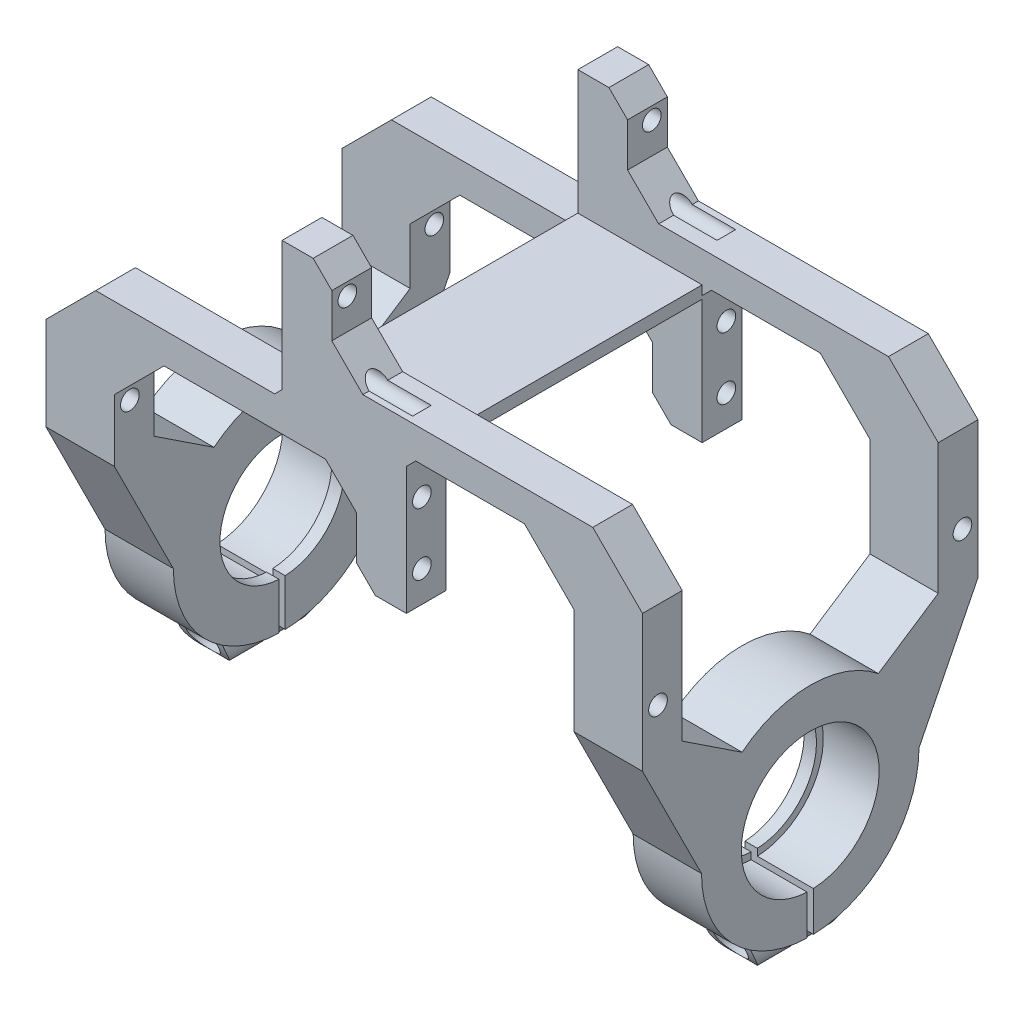
from build123d import *

# Parameters (mm, degrees)
SKETCH1_W               = 20
SKETCH1_H               = 54
BOSS_EXTRUDE1_DEPTH     = 2
SKETCH2_W               = 8
SKETCH2_H               = 6.4
BOSS_EXTRUDE2_DEPTH     = 20
CHAMFER1_SIZE           = 5
SKETCH3_W               = 8
SKETCH3_H               = 6.4
BOSS_EXTRUDE3_DEPTH     = 20
CHAMFER2_SIZE           = 5
CHAMFER3_SIZE           = 3
BOSS_EXTRUDE4_DEPTH     = 6.4
BOSS_EXTRUDE6_DEPTH     = 6.4
CHAMFER4_SIZE           = 5
CHAMFER5_SIZE           = 1.5
SKETCH6_R               = 11.1
BOSS_EXTRUDE5_DEPTH     = 11
CHAMFER6_SIZE           = 8
BOSS_EXTRUDE7_DEPTH     = 6.4
BOSS_EXTRUDE8_DEPTH     = 6.4
BOSS_EXTRUDE9_START     = -11
SKETCH10_W              = 6.4
SKETCH10_H              = 1
SKETCH10_H_2            = 5
SKETCH10_R              = 11.1
SKETCH10_H_3            = 6
BOSS_EXTRUDE9_DEPTH     = 11
BOSS_EXTRUDE10_START    = -11
SKETCH11_R              = 11.1
SKETCH11_R_2            = 10
BOSS_EXTRUDE10_DEPTH    = 2
BOSS_EXTRUDE11_START    = -9
SKETCH12_R              = 11.1
SKETCH12_R_2            = 10
BOSS_EXTRUDE11_DEPTH    = 2
CHAMFER7_SIZE           = 8
CHAMFER8_SIZE           = 5
SKETCH13_R              = 1.5
CUT_EXTRUDE1_DEPTH      = 20
CHAMFER9_SIZE           = 1.2
BOSS_EXTRUDE12_DEPTH    = 8
SKETCH15_R              = 1.5
CUT_EXTRUDE2_DEPTH      = 87.773051821
CUT_EXTRUDE3_DEPTH      = 119.091331234
SKETCH17_W              = 1
SKETCH17_H              = 30
CUT_EXTRUDE4_DEPTH      = 119.091331234
CUT_EXTRUDE5_START      = -4.5
SKETCH18_R              = 2.6
CUT_EXTRUDE5_DEPTH      = 8
CUT_EXTRUDE6_DEPTH      = 119.091331315
CUT_EXTRUDE6_DEPTH_BACK = 119.091331315
SKETCH19_W              = 1
SKETCH19_H              = 12
CUT_EXTRUDE7_START      = -9.5
SKETCH20_R              = 2.6
CUT_EXTRUDE7_DEPTH      = 77.10702379
CUT_EXTRUDE8_DEPTH      = 86.026834133
CUT_EXTRUDE8_DEPTH_BACK = 86.026834133
SKETCH21_R              = 1.5
CUT_EXTRUDE9_DEPTH      = 10


with BuildPart() as part:
    # Sketch1 → Boss-Extrude1 (new body)
    with BuildSketch(Plane(origin=(0, 0, 0), x_dir=(1, 0, 0), z_dir=(0, 1, 0))):
        Rectangle(SKETCH1_W, SKETCH1_H)
    extrude(amount=BOSS_EXTRUDE1_DEPTH)

    # Sketch2 → Boss-Extrude2 (add)
    with BuildSketch(Plane(origin=(0, 2, 0), x_dir=(1, 0, 0), z_dir=(0, 1, 0))):
        with Locations((-6, 23.8)):
            Rectangle(SKETCH2_W, SKETCH2_H)
        with Locations((-6, -23.8)):
            Rectangle(SKETCH2_W, SKETCH2_H)
    extrude(amount=BOSS_EXTRUDE2_DEPTH)

    # Chamfer1
    chamfer1_edges = [part.edges().sort_by_distance(p)[0] for p in [
        (-2, 2, -23.8),
        (-2, 2, 23.8),
    ]]
    chamfer(chamfer1_edges, length=CHAMFER1_SIZE)

    # Sketch3 → Boss-Extrude3 (add)
    with BuildSketch(Plane.XZ):
        with Locations((6, 23.8)):
            Rectangle(SKETCH3_W, SKETCH3_H)
        with Locations((6, -23.8)):
            Rectangle(SKETCH3_W, SKETCH3_H)
    extrude(amount=BOSS_EXTRUDE3_DEPTH)

    # Chamfer2
    chamfer2_edges = [part.edges().sort_by_distance(p)[0] for p in [
        (2, 0, 23.8),
        (2, 0, -23.8),
    ]]
    chamfer(chamfer2_edges, length=CHAMFER2_SIZE)

    # Chamfer3
    chamfer3_edges = [part.edges().sort_by_distance(p)[0] for p in [
        (-2, 22, -23.8),
        (-2, 22, 23.8),
        (2, -20, 23.8),
        (2, -20, -23.8),
    ]]
    chamfer(chamfer3_edges, length=CHAMFER3_SIZE)

    # Sketch5 → Boss-Extrude4 (add)
    with BuildSketch(Plane(origin=(0, 0, -27), x_dir=(-1, 0, 0), z_dir=(0, 0, -1))):
        Polygon((-10, 2), (-48, 2), (-48, 7), (2, 7), (-3, 2), align=None)
    extrude(amount=-BOSS_EXTRUDE4_DEPTH)

    # Sketch7 → Boss-Extrude6 (add)
    with BuildSketch(Plane.XY.offset(27)):
        Polygon((48, 2), (48, 7), (-2, 7), (3, 2), (10, 2), align=None)
    extrude(amount=-BOSS_EXTRUDE6_DEPTH)

    # Chamfer4
    chamfer4_edges = [part.edges().sort_by_distance(p)[0] for p in [
        (-2, 7, -23.8),
        (-2, 7, 23.8),
    ]]
    chamfer(chamfer4_edges, length=CHAMFER4_SIZE)

    # Chamfer5
    chamfer5_edges = [part.edges().sort_by_distance(p)[0] for p in [
        (10, 2, -23.8),
        (10, 2, 23.8),
    ]]
    chamfer(chamfer5_edges, length=CHAMFER5_SIZE)

    # Sketch6 → Boss-Extrude5 (add)
    with BuildSketch(Plane(origin=(48, 0, 0), x_dir=(0, 0, -1), z_dir=(1, 0, 0))):
        with BuildLine():
            Line((27, 2), (27, -23))
            Line((27, -23), (17.5, -42))
            ThreePointArc((17.5, -42), (0, -59.5), (-17.5, -42))
            Line((-17.5, -42), (-27, -23))
            Line((-27, -23), (-27, 2))
            Line((-27, 2), (-20.6, 2))
            Line((-20.6, 2), (-20.6, -22))
            Line((-20.6, -22), (-10.965285243, -28.361359322))
            ThreePointArc((-10.965285243, -28.361359322), (0, -24.5), (10.965285243, -28.361359322))
            Line((10.965285243, -28.361359322), (20.6, -22))
            Line((20.6, -22), (20.6, 2))
            Line((20.6, 2), (27, 2))
        make_face()
        with Locations((0, -42)):
            Circle(SKETCH6_R, mode=Mode.SUBTRACT)
    extrude(amount=-BOSS_EXTRUDE5_DEPTH)

    # Chamfer6
    chamfer6_edges = [part.edges().sort_by_distance(p)[0] for p in [
        (48, 7, -23.8),
        (48, 7, 23.8),
        (37, 2, -23.8),
        (37, 2, 23.8),
    ]]
    chamfer(chamfer6_edges, length=CHAMFER6_SIZE)

    # Sketch8 → Boss-Extrude7 (add)
    with BuildSketch(Plane(origin=(0, 0, -27), x_dir=(-1, 0, 0), z_dir=(0, 0, -1))):
        Polygon((10, 0), (48, 0), (48, -5), (-2, -5), (3, 0), align=None)
    extrude(amount=-BOSS_EXTRUDE7_DEPTH)

    # Sketch9 → Boss-Extrude8 (add)
    with BuildSketch(Plane.XY.offset(27)):
        Polygon((-48, 0), (-48, -5), (2, -5), (-3, 0), (-10, 0), align=None)
    extrude(amount=-BOSS_EXTRUDE8_DEPTH)

    # Sketch10 → Boss-Extrude9 (add)
    # profile 1 of 4: a face of its own
    with BuildSketch(Plane.ZY.offset(48).offset(BOSS_EXTRUDE9_START)):
        with Locations((-23.8, -5.5)):
            Rectangle(SKETCH10_W, SKETCH10_H)
    # profile 2 of 4: a face of its own
    with BuildSketch(Plane.ZY.offset(48).offset(BOSS_EXTRUDE9_START)):
        with Locations((-23.8, -2.5)):
            Rectangle(SKETCH10_W, SKETCH10_H_2)
    # profile 3 of 4: a face of its own
    with BuildSketch(Plane.ZY.offset(48).offset(BOSS_EXTRUDE9_START)):
        with BuildLine():
            Line((-20.6, -6), (-27, -6))
            Line((-27, -6), (-27, -23))
            Line((-27, -23), (-17.5, -42))
            ThreePointArc((-17.5, -42), (0, -59.5), (17.5, -42))
            Line((17.5, -42), (27, -23))
            Line((27, -23), (27, -6))
            Line((27, -6), (20.6, -6))
            Line((20.6, -6), (20.6, -22))
            Line((20.6, -22), (10.965285243, -28.361359322))
            ThreePointArc((10.965285243, -28.361359322), (0, -24.5), (-10.965285243, -28.361359322))
            Line((-10.965285243, -28.361359322), (-20.6, -22))
            Line((-20.6, -22), (-20.6, -6))
        make_face()
        with Locations(Location((0, -42, 0), (0, 0, 180))):
            Circle(SKETCH10_R, mode=Mode.SUBTRACT)
    # profile 4 of 4: a face of its own
    with BuildSketch(Plane.ZY.offset(48).offset(BOSS_EXTRUDE9_START)):
        with Locations((23.8, -3)):
            Rectangle(SKETCH10_W, SKETCH10_H_3)
    extrude(amount=BOSS_EXTRUDE9_DEPTH)

    # Sketch11 → Boss-Extrude10 (add)
    with BuildSketch(Plane.ZY.offset(48).offset(BOSS_EXTRUDE10_START)):
        with Locations(Location((0, -42, 0), (0, 0, 180))):
            Circle(SKETCH11_R)
        with Locations((0, -42)):
            Circle(SKETCH11_R_2, mode=Mode.SUBTRACT)
    extrude(amount=BOSS_EXTRUDE10_DEPTH)

    # Sketch12 → Boss-Extrude11 (add)
    with BuildSketch(Plane(origin=(48, 0, 0), x_dir=(0, 0, -1), z_dir=(1, 0, 0)).offset(BOSS_EXTRUDE11_START)):
        with Locations((0, -42)):
            Circle(SKETCH12_R)
        with Locations(Location((0, -42, 0), (0, 0, 180))):
            Circle(SKETCH12_R_2, mode=Mode.SUBTRACT)
    extrude(amount=-BOSS_EXTRUDE11_DEPTH)

    # Chamfer7
    chamfer7_edges = [part.edges().sort_by_distance(p)[0] for p in [
        (-48, 0, -23.8),
        (-48, 0, 23.8),
        (-37, -5, -23.8),
        (-37, -5, 23.8),
    ]]
    chamfer(chamfer7_edges, length=CHAMFER7_SIZE)

    # Chamfer8
    chamfer8_edges = [part.edges().sort_by_distance(p)[0] for p in [
        (2, -5, 23.8),
        (2, -5, -23.8),
    ]]
    chamfer(chamfer8_edges, length=CHAMFER8_SIZE)

    # Sketch13 → Cut-Extrude1 (cut)
    with BuildSketch(Plane(origin=(10, 0, 0), x_dir=(0, 0, -1), z_dir=(1, 0, 0))):
        with Locations((24.5, -15)):
            Circle(SKETCH13_R)
        with Locations((24.5, -5)):
            Circle(SKETCH13_R)
        with Locations((-24.5, -15)):
            Circle(SKETCH13_R)
        with Locations((-24.5, -5)):
            Circle(SKETCH13_R)
        with Locations((-24.5, 7)):
            Circle(SKETCH13_R)
        with Locations((-24.5, 17)):
            Circle(SKETCH13_R)
        with Locations((24.5, 7)):
            Circle(SKETCH13_R)
        with Locations((24.5, 17)):
            Circle(SKETCH13_R)
    extrude(amount=-CUT_EXTRUDE1_DEPTH, mode=Mode.SUBTRACT)

    # Chamfer9
    chamfer9_edges = [part.edges().sort_by_distance(p)[0] for p in [
        (-10, 0, 23.8),
        (-10, 0, -23.8),
    ]]
    chamfer(chamfer9_edges, length=CHAMFER9_SIZE)

    # Sketch14 → Boss-Extrude12 (add, symmetric)
    with BuildSketch(Plane.XY):
        with BuildLine():
            ThreePointArc((-44, -59.5), (-42.5, -58), (-41, -59.5))
            Line((-41, -59.5), (-38.75, -59.5))
            ThreePointArc((-38.75, -59.5), (-42.5, -55.75), (-46.25, -59.5))
            Line((-46.25, -59.5), (-44, -59.5))
        make_face()
        with BuildLine():
            Line((-38.75, -59.5), (-41, -59.5))
            ThreePointArc((-41, -59.5), (-42.5, -61), (-44, -59.5))
            Line((-44, -59.5), (-46.25, -59.5))
            ThreePointArc((-46.25, -59.5), (-42.5, -63.25), (-38.75, -59.5))
        make_face()
    boss_extrude12 = extrude(amount=BOSS_EXTRUDE12_DEPTH, both=True)

    # Sketch15 → Cut-Extrude2 (cut, through all)
    with BuildSketch(Plane(origin=(0, 0, -8), x_dir=(-1, 0, 0), z_dir=(0, 0, -1))):
        with Locations(Location((42.5, -59.5, 0), (0, 0, 180))):
            Circle(SKETCH15_R)
    cut_extrude2 = extrude(amount=-CUT_EXTRUDE2_DEPTH, mode=Mode.SUBTRACT)

    # Sketch16 → Cut-Extrude3 (cut, through all)
    with BuildSketch(Plane.ZY.offset(48)):
        with BuildLine():
            Line((4.5, -63.25), (8, -63.25))
            Line((8, -63.25), (8, -57.564382416))
            add(Edge.make_bspline(
                [(8, -57.564382416), (7.188643503, -61.011616818), (4.5, -63.25)],
                knots=[0, 0, 0, 1, 1, 1], degree=2))
        make_face()
        with BuildLine():
            Line((-8, -63.25), (-8, -57.564382416))
            add(Edge.make_bspline(
                [(-8, -57.564382416), (-7.188643503, -61.011616818), (-4.5, -63.25)],
                knots=[0, 0, 0, 1, 1, 1], degree=2))
            Line((-4.5, -63.25), (-8, -63.25))
        make_face()
    cut_extrude3 = extrude(amount=-CUT_EXTRUDE3_DEPTH, mode=Mode.SUBTRACT)

    # Sketch17 → Cut-Extrude4 (cut, through all)
    with BuildSketch(Plane.ZY.offset(48)):
        with Locations((0, -63.25)):
            Rectangle(SKETCH17_W, SKETCH17_H)
    extrude(amount=-CUT_EXTRUDE4_DEPTH, mode=Mode.SUBTRACT)

    # Sketch18 → Cut-Extrude5 (cut)
    with BuildSketch(Plane.XY.offset(-0.5).offset(CUT_EXTRUDE5_START)):
        with Locations((-42.5, -59.5)):
            Circle(SKETCH18_R)
    cut_extrude5 = extrude(amount=-CUT_EXTRUDE5_DEPTH, mode=Mode.SUBTRACT)

    # Mirror1: Boss-Extrude12, Cut-Extrude2, Cut-Extrude3, Cut-Extrude5 across plane
    add(boss_extrude12.mirror(Plane(origin=(0, 0, 0), x_dir=(0, 0, 1), z_dir=(1, 0, 0))))
    add(cut_extrude2.mirror(Plane(origin=(0, 0, 0), x_dir=(0, 0, 1), z_dir=(1, 0, 0))), mode=Mode.SUBTRACT)
    add(cut_extrude3.mirror(Plane(origin=(0, 0, 0), x_dir=(0, 0, 1), z_dir=(1, 0, 0))), mode=Mode.SUBTRACT)
    add(cut_extrude5.mirror(Plane(origin=(0, 0, 0), x_dir=(0, 0, 1), z_dir=(1, 0, 0))), mode=Mode.SUBTRACT)

    # Sketch19 → Cut-Extrude6 (cut, two sides: drawn at the far end of the back side and taken through both)
    with BuildSketch(Plane.ZY.offset(48).offset(-CUT_EXTRUDE6_DEPTH_BACK)):
        with Locations((0, -57.987492178)):
            Rectangle(SKETCH19_W, SKETCH19_H)
    extrude(amount=CUT_EXTRUDE6_DEPTH + CUT_EXTRUDE6_DEPTH_BACK, mode=Mode.SUBTRACT)

    # Sketch20 → Cut-Extrude7 (cut, through all)
    with BuildSketch(Plane(origin=(0, 0, -5), x_dir=(-1, 0, 0), z_dir=(0, 0, -1)).offset(CUT_EXTRUDE7_START)):
        with Locations(Location((42.5, -59.5, 0), (0, 0, 180))):
            Circle(SKETCH20_R)
        with Locations(Location((-42.5, -59.5, 0), (0, 0, 131.886549642))):
            Circle(SKETCH20_R)
    extrude(amount=-CUT_EXTRUDE7_DEPTH, mode=Mode.SUBTRACT)

    # Sketch21 → Cut-Extrude8 (cut, two sides: drawn at the far end of the back side and taken through both)
    with BuildSketch(Plane.ZY.offset(-2).offset(-CUT_EXTRUDE8_DEPTH_BACK)):
        with Locations(Location((24.5, -15, 0), (0, 0, 180))):
            Circle(SKETCH21_R)
        with Locations(Location((-24.5, -15, 0), (0, 0, 180))):
            Circle(SKETCH21_R)
    extrude(amount=CUT_EXTRUDE8_DEPTH + CUT_EXTRUDE8_DEPTH_BACK, mode=Mode.SUBTRACT)

    # Sketch22 → Cut-Extrude9 (cut)
    with BuildSketch(Plane(origin=(0, 0, -5), x_dir=(-1, 0, 0), z_dir=(0, 0, -1))):
        Polygon((-44.08771324, -62.25), (-40.91228676, -62.25), (-39.324573519, -59.5), (-40.91228676, -56.75), (-44.08771324, -56.75), (-45.675426481, -59.5), align=None)
        Polygon((40.91228676, -62.25), (44.08771324, -62.25), (45.675426481, -59.5), (44.08771324, -56.75), (40.91228676, -56.75), (39.324573519, -59.5), align=None)
    extrude(amount=CUT_EXTRUDE9_DEPTH, mode=Mode.SUBTRACT)


solid = part.part
